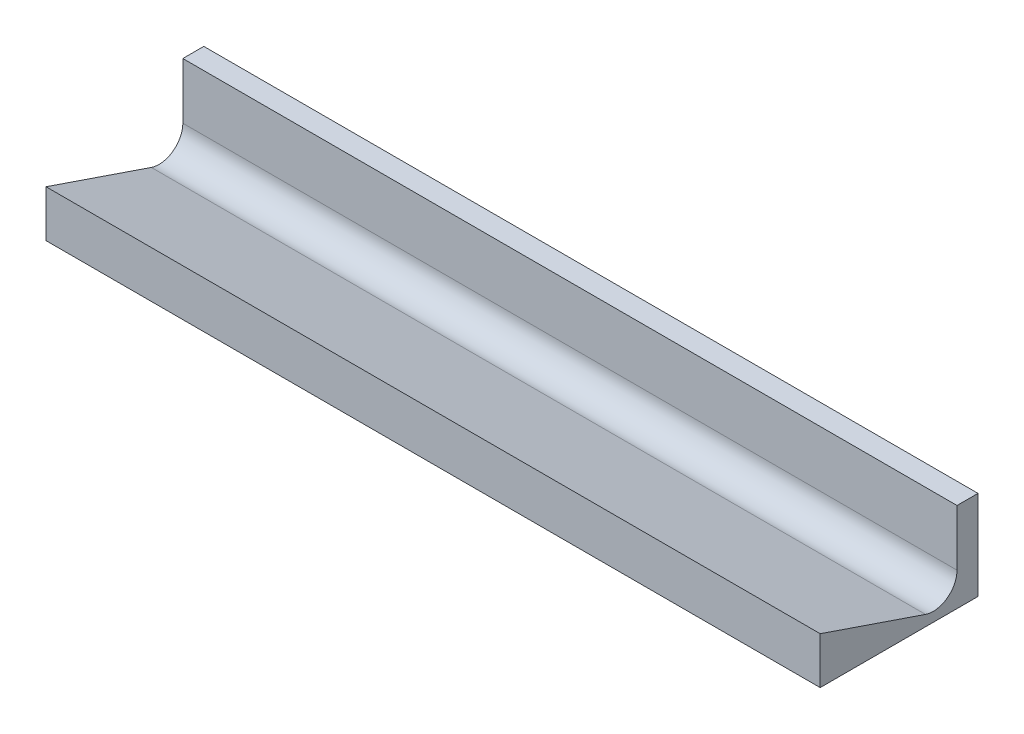
from build123d import *

# Parameters (mm, degrees)
SKETCH1_W               = 130
SKETCH1_H               = 26.5
BOSS_EXTRUDE2_DEPTH     = 15
CUT_EXTRUDE1_DEPTH      = 132.531602666
CUT_EXTRUDE1_DEPTH_BACK = 132.531602666
SKETCH4_W               = 5
SKETCH4_H               = 7
BOSS_EXTRUDE3_DEPTH     = 8
BOSS_EXTRUDE4_DEPTH     = 3.5
SKETCH5_3_W             = 1
SKETCH5_3_H             = 8
CUT_EXTRUDE2_DEPTH      = 3.5


with BuildPart() as part:
    # Sketch1 → Boss-Extrude2 (new body)
    with BuildSketch(Plane(origin=(0, 0, 0), x_dir=(1, 0, 0), z_dir=(0, 1, 0))):
        Rectangle(SKETCH1_W, SKETCH1_H)
    extrude(amount=BOSS_EXTRUDE2_DEPTH)

    # Sketch2 → Cut-Extrude1 (cut, two sides: drawn at the far end of the back side and taken through both)
    with BuildSketch(Plane.ZY.offset(65).offset(-CUT_EXTRUDE1_DEPTH_BACK)):
        with BuildLine():
            Line((-4.434381462, 1.80539147), (13.25, 7.838944467))
            Line((13.25, 7.838944467), (13.25, 15))
            Line((13.25, 15), (-9.725995121, 15))
            Line((-9.725995121, 15), (-9.725995121, 5.591119162))
            ThreePointArc((-9.725995121, 5.591119162), (-8.053391237, 2.337931907), (-4.434381462, 1.80539147))
        make_face()
    extrude(amount=CUT_EXTRUDE1_DEPTH + CUT_EXTRUDE1_DEPTH_BACK, mode=Mode.SUBTRACT)

    # Sketch4 → Boss-Extrude3 (add)
    with BuildSketch(Plane.XZ):
        with Locations((-42.5, -4.75)):
            Rectangle(SKETCH4_W, SKETCH4_H)
        with Locations((42.5, -4.75)):
            Rectangle(SKETCH4_W, SKETCH4_H)
    extrude(amount=BOSS_EXTRUDE3_DEPTH)

    # Sketch5 → Boss-Extrude4 (add, symmetric)
    with BuildSketch(Plane.XY.offset(-4.75)):
        Polygon((-45, -8), (-45, -5), (-46, -5), align=None)
        Polygon((-40, -5), (-40, -8), (-39, -5), align=None)
        Polygon((46, -5), (45, -5), (45, -8), align=None)
        Polygon((40, -8), (40, -5), (39, -5), align=None)
    extrude(amount=BOSS_EXTRUDE4_DEPTH, both=True)

    # Sketch5<3> → Cut-Extrude2 (cut, symmetric)
    with BuildSketch(Plane.XY.offset(-4.75)):
        with Locations((-42.5, -4)):
            Rectangle(SKETCH5_3_W, SKETCH5_3_H)
        with Locations((42.5, -4)):
            Rectangle(SKETCH5_3_W, SKETCH5_3_H)
    extrude(amount=CUT_EXTRUDE2_DEPTH, both=True, mode=Mode.SUBTRACT)


solid = part.part
